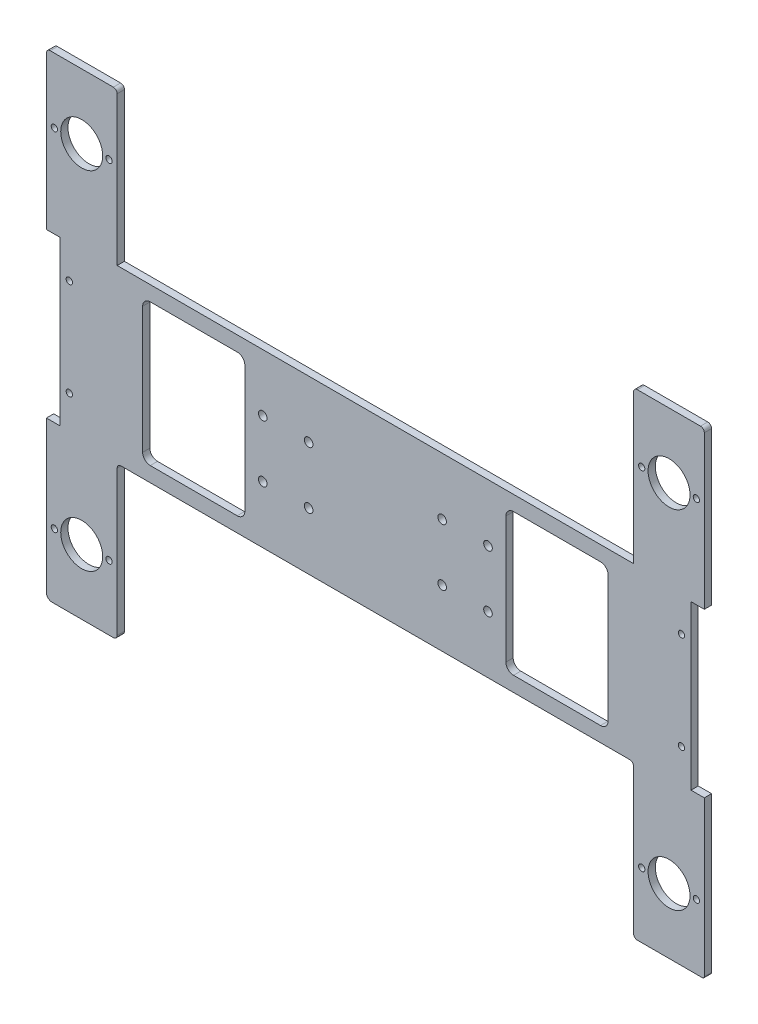
from build123d import *

# Parameters (mm, degrees)
SKETCH2_R           = 1.65
SKETCH2_R_2         = 11
SKETCH2_R_3         = 2.25
BOSS_EXTRUDE1_DEPTH = 3.8


with BuildPart() as part:
    # Sketch2 → Boss-Extrude1 (new body)
    with BuildSketch(Plane.XY):
        with BuildLine():
            Line((-170.5, 150), (-137.4, 150))
            ThreePointArc((-137.4, 150), (-135.985786438, 149.414213562), (-135.4, 148))
            Line((-135.4, 148), (-135.4, 70))
            Line((-135.4, 70), (135.4, 70))
            Line((135.4, 70), (135.4, 148))
            ThreePointArc((135.4, 148), (135.985786438, 149.414213562), (137.4, 150))
            Line((137.4, 150), (170.5, 150))
            ThreePointArc((170.5, 150), (171.914213562, 149.414213562), (172.5, 148))
            Line((172.5, 148), (172.5, 67.8042249))
            Line((172.5, 67.8042249), (165.5, 67.8042249))
            Line((165.5, 67.8042249), (165.5, -17.8042249))
            Line((165.5, -17.8042249), (172.5, -17.8042249))
            Line((172.5, -17.8042249), (172.5, -99))
            ThreePointArc((172.5, -99), (172.207106781, -99.707106781), (171.5, -100))
            Line((171.5, -100), (137.4, -100))
            ThreePointArc((137.4, -100), (135.985786438, -99.414213562), (135.4, -98))
            Line((135.4, -98), (135.4, -22))
            ThreePointArc((135.4, -22), (134.814213562, -20.585786438), (133.4, -20))
            Line((133.4, -20), (-133.4, -20))
            ThreePointArc((-133.4, -20), (-134.814213562, -20.585786438), (-135.4, -22))
            Line((-135.4, -22), (-135.4, -98))
            ThreePointArc((-135.4, -98), (-135.985786438, -99.414213562), (-137.4, -100))
            Line((-137.4, -100), (-169.5, -100))
            ThreePointArc((-169.5, -100), (-171.621320344, -99.121320344), (-172.5, -97))
            Line((-172.5, -97), (-172.5, -17.8042249))
            Line((-172.5, -17.8042249), (-165.5, -17.8042249))
            Line((-165.5, -17.8042249), (-165.5, 67.8042249))
            Line((-165.5, 67.8042249), (-172.5, 67.8042249))
            Line((-172.5, 67.8042249), (-172.5, 148))
            ThreePointArc((-172.5, 148), (-171.914213562, 149.414213562), (-170.5, 150))
        make_face()
        with Locations(Location((-168.334802826, 116, 0), (0, 0, 180))):
            Circle(SKETCH2_R, mode=Mode.SUBTRACT)
        with Locations(Location((-139.665197174, 116, 0), (0, 0, 180))):
            Circle(SKETCH2_R, mode=Mode.SUBTRACT)
        with Locations(Location((168.334802826, 116, 0), (0, 0, 180))):
            Circle(SKETCH2_R, mode=Mode.SUBTRACT)
        with Locations(Location((139.665197174, 116, 0), (0, 0, 180))):
            Circle(SKETCH2_R, mode=Mode.SUBTRACT)
        with Locations(Location((154, 116, 0), (0, 0, 180))):
            Circle(SKETCH2_R_2, mode=Mode.SUBTRACT)
        with Locations(Location((-154, 116, 0), (0, 0, 180))):
            Circle(SKETCH2_R_2, mode=Mode.SUBTRACT)
        with Locations(Location((160.5, -0.5, 0), (0, 0, 180))):
            Circle(SKETCH2_R, mode=Mode.SUBTRACT)
        with Locations(Location((160.5, 50.5, 0), (0, 0, 180))):
            Circle(SKETCH2_R, mode=Mode.SUBTRACT)
        with Locations(Location((-160.5, -0.5, 0), (0, 0, 180))):
            Circle(SKETCH2_R, mode=Mode.SUBTRACT)
        with Locations(Location((-160.5, 50.5, 0), (0, 0, 180))):
            Circle(SKETCH2_R, mode=Mode.SUBTRACT)
        with Locations(Location((-35, 10.055, 0), (0, 0, 180))):
            Circle(SKETCH2_R_3, mode=Mode.SUBTRACT)
        with Locations(Location((-35, 39.945, 0), (0, 0, 180))):
            Circle(SKETCH2_R_3, mode=Mode.SUBTRACT)
        with Locations(Location((-59.06, 39.945, 0), (0, 0, 180))):
            Circle(SKETCH2_R_3, mode=Mode.SUBTRACT)
        with Locations(Location((-59.06, 10.055, 0), (0, 0, 180))):
            Circle(SKETCH2_R_3, mode=Mode.SUBTRACT)
        with Locations(Location((59.06, 10.055, 0), (0, 0, 180))):
            Circle(SKETCH2_R_3, mode=Mode.SUBTRACT)
        with Locations(Location((35, 10.055, 0), (0, 0, 180))):
            Circle(SKETCH2_R_3, mode=Mode.SUBTRACT)
        with Locations(Location((35, 39.945, 0), (0, 0, 180))):
            Circle(SKETCH2_R_3, mode=Mode.SUBTRACT)
        with Locations(Location((59.06, 39.945, 0), (0, 0, 180))):
            Circle(SKETCH2_R_3, mode=Mode.SUBTRACT)
        with Locations(Location((168.334802826, -66, 0), (0, 0, 180))):
            Circle(SKETCH2_R, mode=Mode.SUBTRACT)
        with Locations(Location((139.665197174, -66, 0), (0, 0, 180))):
            Circle(SKETCH2_R, mode=Mode.SUBTRACT)
        with Locations(Location((154, -66, 0), (0, 0, 180))):
            Circle(SKETCH2_R_2, mode=Mode.SUBTRACT)
        with Locations(Location((-154, -66, 0), (0, 0, 180))):
            Circle(SKETCH2_R_2, mode=Mode.SUBTRACT)
        with Locations(Location((-139.665197174, -66, 0), (0, 0, 180))):
            Circle(SKETCH2_R, mode=Mode.SUBTRACT)
        with Locations(Location((-168.334802826, -66, 0), (0, 0, 180))):
            Circle(SKETCH2_R, mode=Mode.SUBTRACT)
        with BuildLine():
            Line((-72.45742566, 62.171403079), (-118.05517368, 62.171403079))
            ThreePointArc((-118.05517368, 62.171403079), (-120.883600805, 60.999830204), (-122.05517368, 58.171403079))
            Line((-122.05517368, 58.171403079), (-122.05517368, -8.171403079))
            ThreePointArc((-122.05517368, -8.171403079), (-120.883600805, -10.999830204), (-118.05517368, -12.171403079))
            Line((-118.05517368, -12.171403079), (-72.45742566, -12.171403079))
            ThreePointArc((-72.45742566, -12.171403079), (-69.628998535, -10.999830204), (-68.45742566, -8.171403079))
            Line((-68.45742566, -8.171403079), (-68.45742566, 58.171403079))
            ThreePointArc((-68.45742566, 58.171403079), (-69.628998535, 60.999830204), (-72.45742566, 62.171403079))
        make_face(mode=Mode.SUBTRACT)
        with BuildLine():
            Line((72.45742566, 62.171403079), (118.05517368, 62.171403079))
            ThreePointArc((118.05517368, 62.171403079), (120.883600805, 60.999830204), (122.05517368, 58.171403079))
            Line((122.05517368, 58.171403079), (122.05517368, -8.171403079))
            ThreePointArc((122.05517368, -8.171403079), (120.883600805, -10.999830204), (118.05517368, -12.171403079))
            Line((118.05517368, -12.171403079), (72.45742566, -12.171403079))
            ThreePointArc((72.45742566, -12.171403079), (69.628998535, -10.999830204), (68.45742566, -8.171403079))
            Line((68.45742566, -8.171403079), (68.45742566, 58.171403079))
            ThreePointArc((68.45742566, 58.171403079), (69.628998535, 60.999830204), (72.45742566, 62.171403079))
        make_face(mode=Mode.SUBTRACT)
    extrude(amount=BOSS_EXTRUDE1_DEPTH)


solid = part.part
